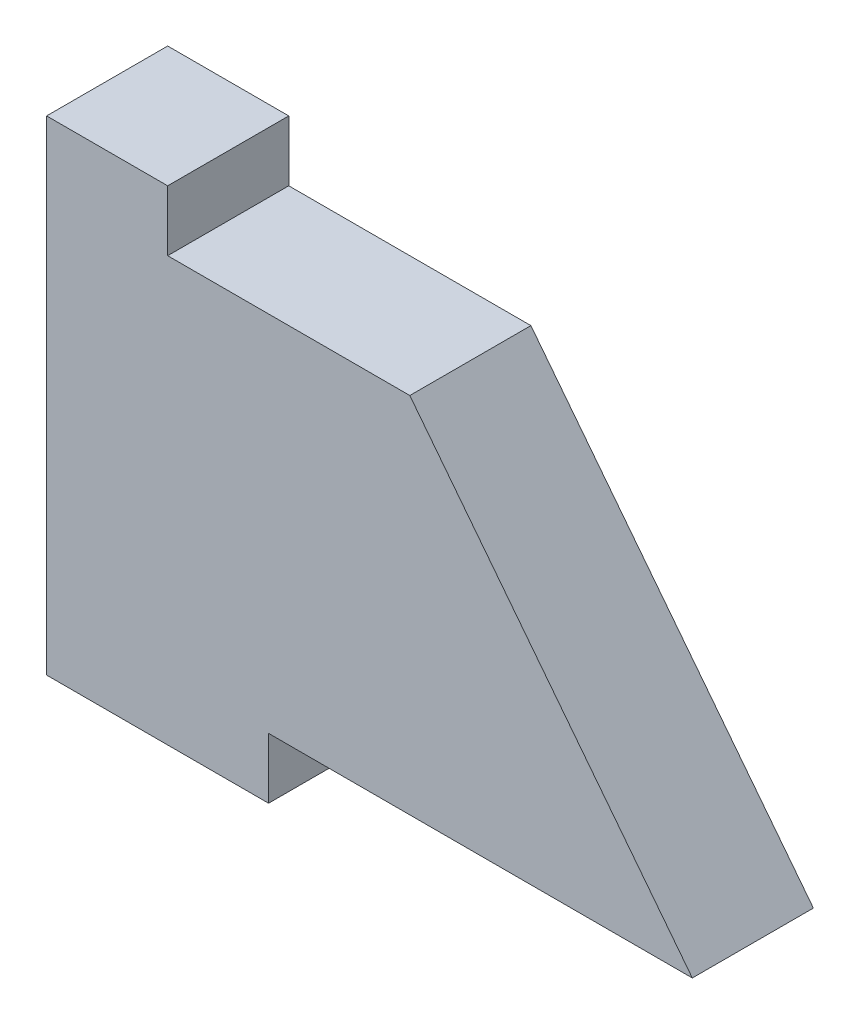
from build123d import *

# Parameters (mm, degrees)
EXTRUDE_1_DEPTH = 3
SKETCH_2_W      = 3
SKETCH_2_H      = 3
EXTRUDE_2_DEPTH = 1.5
SKETCH_3_W      = 5.5
SKETCH_3_H      = 3
EXTRUDE_3_DEPTH = 1.5


with BuildPart() as part:
    # Эскиз1 → Бобышка-Вытянуть1 (new body)
    with BuildSketch(Plane.XY):
        Polygon((0, 9), (0, 0), (16, 0), (9, 9), align=None)
    extrude(amount=EXTRUDE_1_DEPTH)

    # Эскиз2 → Бобышка-Вытянуть2 (add)
    with BuildSketch(Plane(origin=(0, 9, 0), x_dir=(1, 0, 0), z_dir=(0, 1, 0))):
        with Locations((1.5, -1.5)):
            Rectangle(SKETCH_2_W, SKETCH_2_H)
    extrude(amount=EXTRUDE_2_DEPTH)

    # Эскиз3 → Бобышка-Вытянуть3 (add)
    with BuildSketch(Plane.XZ):
        with Locations((2.75, 1.5)):
            Rectangle(SKETCH_3_W, SKETCH_3_H)
    extrude(amount=EXTRUDE_3_DEPTH)


solid = part.part
